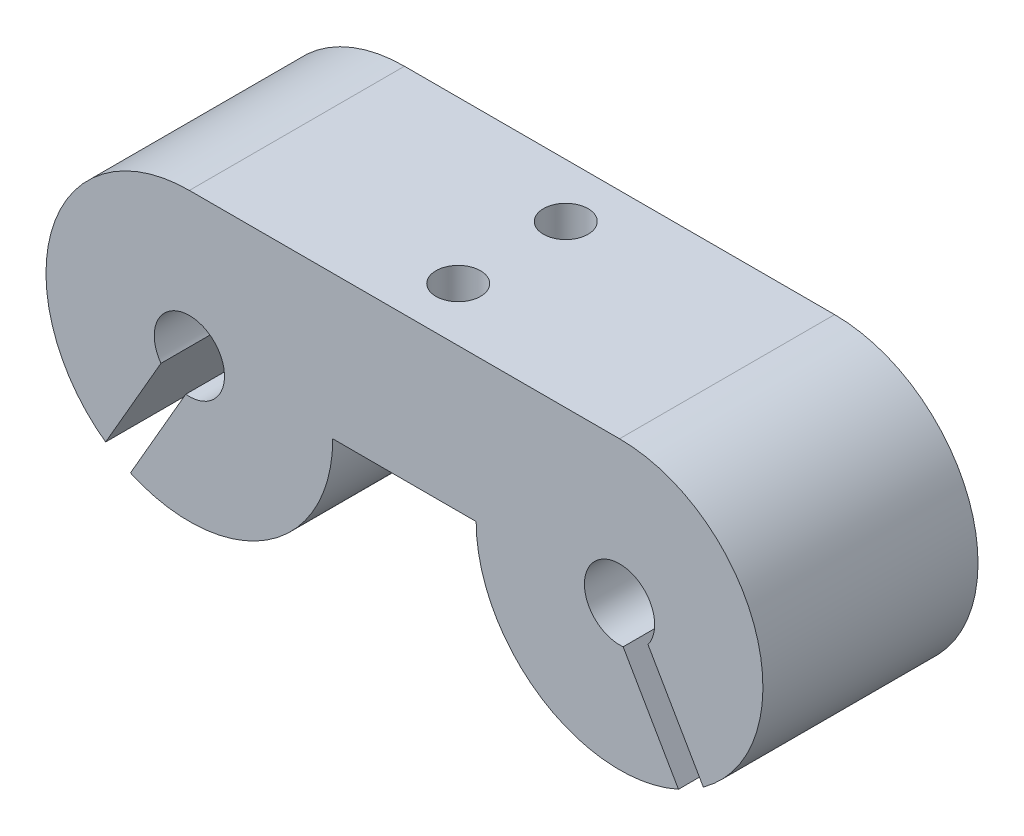
from build123d import *

# Parameters (mm, degrees)
BOSS_EXTRUDE1_DEPTH             = 15
SKETCH3_R                       = 2.45
CUT_EXTRUDE1_DEPTH              = 31.822070015
CUT_EXTRUDE2_DEPTH              = 31.822070015
F_3_0MM_CLEARANCE_DOWEL_HOLE1_D = 3.108


with BuildPart() as part:
    # Sketch2 → Boss-Extrude1 (new body)
    with BuildSketch(Plane.XY):
        with BuildLine():
            Line((-5, 10), (-15, 10))
            ThreePointArc((-15, 10), (-22.071067812, -7.071067812), (-5, 0))
            Line((-5, 0), (5, 0))
            ThreePointArc((5, 0), (22.071067812, -7.071067812), (15, 10))
            Line((15, 10), (5, 10))
            Line((5, 10), (-5, 10))
        make_face()
    extrude(amount=BOSS_EXTRUDE1_DEPTH)

    # Sketch3 → Cut-Extrude1 (cut, through all)
    with BuildSketch(Plane.XY.offset(15)):
        with Locations((-15, 0)):
            Circle(SKETCH3_R)
        with Locations((15, 0)):
            Circle(SKETCH3_R)
    extrude(amount=-CUT_EXTRUDE1_DEPTH, mode=Mode.SUBTRACT)

    # Sketch4 → Cut-Extrude2 (cut, through all)
    with BuildSketch(Plane.XY.offset(15)):
        Polygon((-14.133974596, -0.5), (-15.866025404, 0.5), (-20.866025404, -8.160254038), (-19.133974596, -9.160254038), align=None)
        Polygon((14.133974596, -0.5), (15.866025404, 0.5), (20.866025404, -8.160254038), (19.133974596, -9.160254038), align=None)
    extrude(amount=-CUT_EXTRUDE2_DEPTH, mode=Mode.SUBTRACT)

    # Ø3.0mm Clearance Dowel Hole1 (through all)
    with Locations(Plane(origin=(0, 0, 0), x_dir=(-1, 0, 0), z_dir=(0, -1, 0))):
        with Locations((0, -3.75), (0, -11.25)):
            Hole(F_3_0MM_CLEARANCE_DOWEL_HOLE1_D / 2)


solid = part.part
